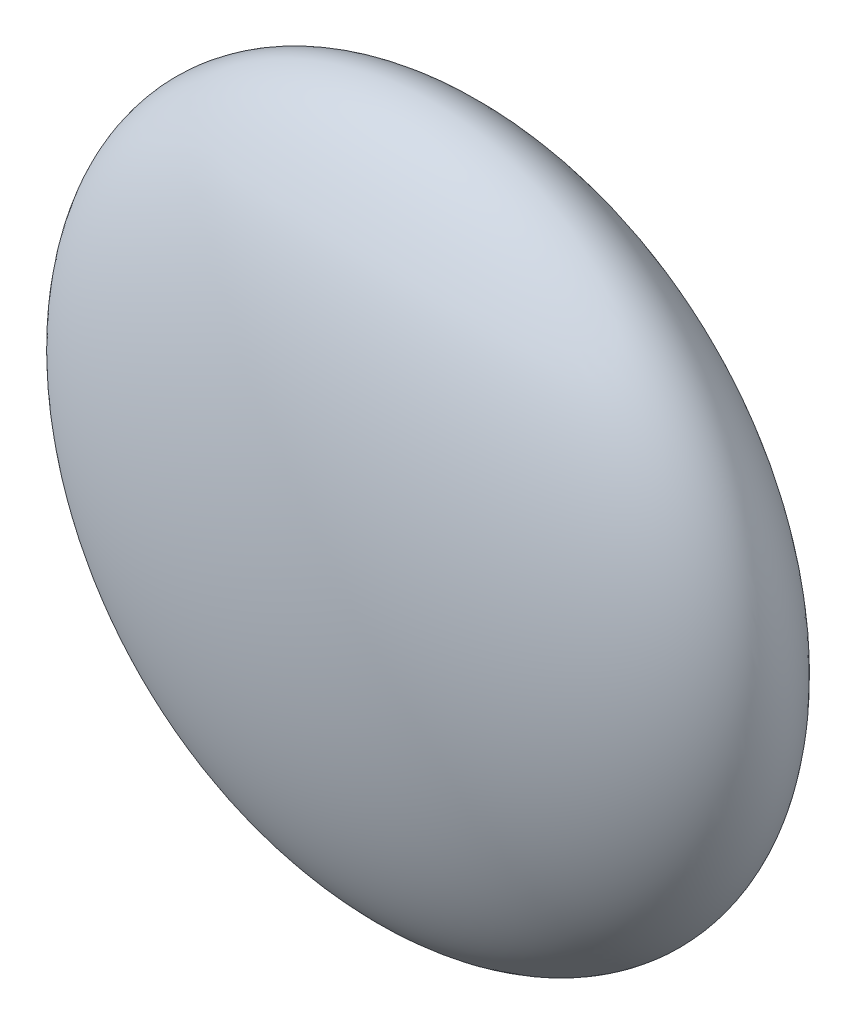
from build123d import *


with BuildPart() as part:
    # Sketch1 → Revolve1 (revolve)
    with BuildSketch(Plane(origin=(0, 0, 0), x_dir=(0, 0, -1), z_dir=(1, 0, 0))):
        with BuildLine():
            Line((-0.242, 0), (0.242, 0))
            add(Edge.make_bspline(
                [(0.242, 0), (0.242, 0.625), (0, 0.625), (-0.242, 0.625), (-0.242, 0)],
                knots=[4.71238898, 4.71238898, 4.71238898, 6.283185307, 6.283185307, 7.853981634, 7.853981634, 7.853981634], degree=2, weights=[1, 0.707106781, 1, 0.707106781, 1]))
        make_face()
    revolve(axis=Axis((0, 0, 0.242), (0, 0, -1)))


solid = part.part
